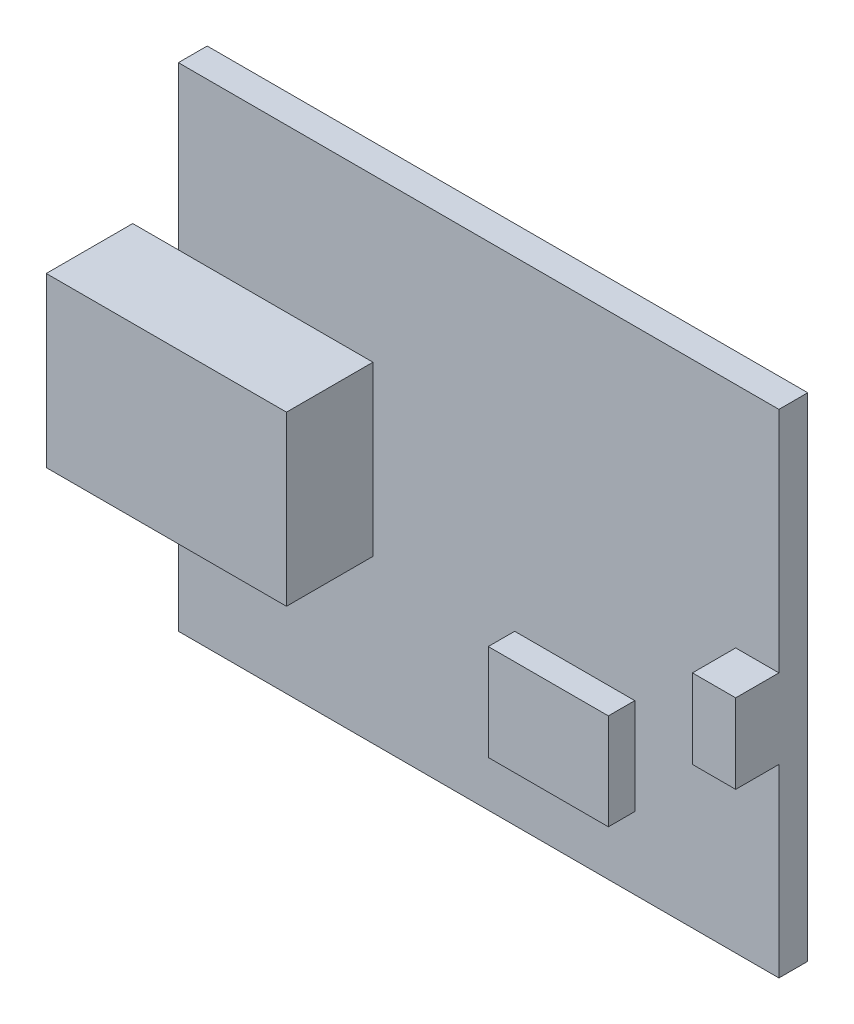
from build123d import *

# Parameters (mm, degrees)
SKETCH1_W            = 25
SKETCH1_H            = 20.5
BOSS_EXTRUDE1_DEPTH  = 1.2
USB_START            = 1.9
SKETCH2_W            = 3.6
SKETCH2_H            = 7
USB_CONNECTOR_DEPTH  = 10
SKETCH3_W            = 1.8
SKETCH3_H            = 3.3
MICROPROCESSOR_DEPTH = 1.8
SKETCH4_W            = 5
SKETCH4_H            = 4
BUTTON_BASE_DEPTH    = 1.1


with BuildPart() as part:
    # Sketch1 → Boss-Extrude1 (new body)
    with BuildSketch(Plane.XY):
        Rectangle(SKETCH1_W, SKETCH1_H)
    extrude(amount=BOSS_EXTRUDE1_DEPTH)

    # Sketch2 → USB Connector (add)
    with BuildSketch(Plane.ZY.offset(12.5).offset(USB_START)):
        with Locations((3, 0)):
            Rectangle(SKETCH2_W, SKETCH2_H)
    extrude(amount=-USB_CONNECTOR_DEPTH)

    # Sketch3 → MicroProcessor (add)
    with BuildSketch(Plane.XY.offset(1.2)):
        with Locations((11.6, -0.9)):
            Rectangle(SKETCH3_W, SKETCH3_H)
    extrude(amount=MICROPROCESSOR_DEPTH)

    # Sketch4 → Button Base (add)
    with BuildSketch(Plane.XY.offset(1.2)):
        with Locations((4, -5.25)):
            Rectangle(SKETCH4_W, SKETCH4_H)
    extrude(amount=BUTTON_BASE_DEPTH)


solid = part.part
